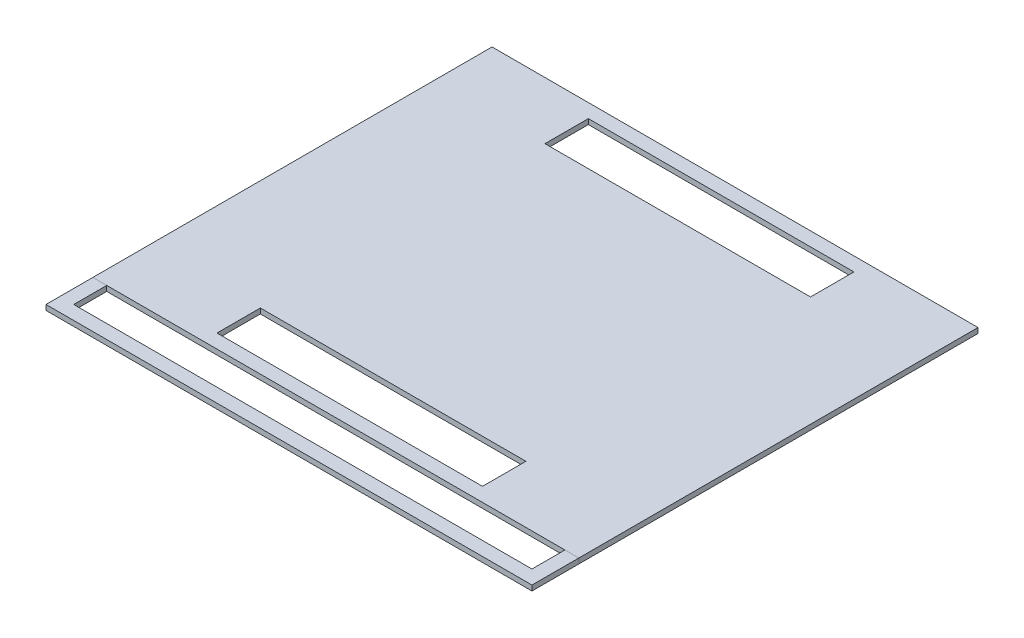
from build123d import *

# Parameters (mm, degrees)
SKETCH1_W           = 280
SKETCH1_H           = 230
BOSS_EXTRUDE1_DEPTH = 3
SKETCH4_W           = 153
SKETCH4_H           = 25
CUT_EXTRUDE2_DEPTH  = 363.365837242
SKETCH5_W           = 280
SKETCH5_H           = 27
BOSS_EXTRUDE2_DEPTH = 3
SKETCH7_W           = 264
SKETCH7_H           = 19
CUT_EXTRUDE4_DEPTH  = 363.365837242


with BuildPart() as part:
    # Sketch1 → Boss-Extrude1 (new body)
    with BuildSketch(Plane(origin=(0, 0, 0), x_dir=(1, 0, 0), z_dir=(0, 1, 0))):
        with Locations((-140, 115)):
            Rectangle(SKETCH1_W, SKETCH1_H)
    extrude(amount=BOSS_EXTRUDE1_DEPTH)

    # Sketch4 → Cut-Extrude2 (cut, through all)
    with BuildSketch(Plane(origin=(0, 3, 0), x_dir=(1, 0, 0), z_dir=(0, 1, 0))):
        with Locations((-140, 209.5)):
            Rectangle(SKETCH4_W, SKETCH4_H)
        with Locations((-140, 20.5)):
            Rectangle(SKETCH4_W, SKETCH4_H)
    extrude(amount=-CUT_EXTRUDE2_DEPTH, mode=Mode.SUBTRACT)


with BuildPart() as body_2:
    # Sketch5 → Boss-Extrude2 (new body)
    with BuildSketch(Plane(origin=(0, 3, 0), x_dir=(1, 0, 0), z_dir=(0, 1, 0))):
        with Locations((-140, -13.5)):
            Rectangle(SKETCH5_W, SKETCH5_H)
    extrude(amount=-BOSS_EXTRUDE2_DEPTH)

    # Sketch7 → Cut-Extrude4 (cut, through all)
    with BuildSketch(Plane(origin=(0, 3, 0), x_dir=(1, 0, 0), z_dir=(0, 1, 0))):
        with Locations((-140, -9.5)):
            Rectangle(SKETCH7_W, SKETCH7_H)
    extrude(amount=-CUT_EXTRUDE4_DEPTH, mode=Mode.SUBTRACT)


solid = Compound([part.part, body_2.part])
